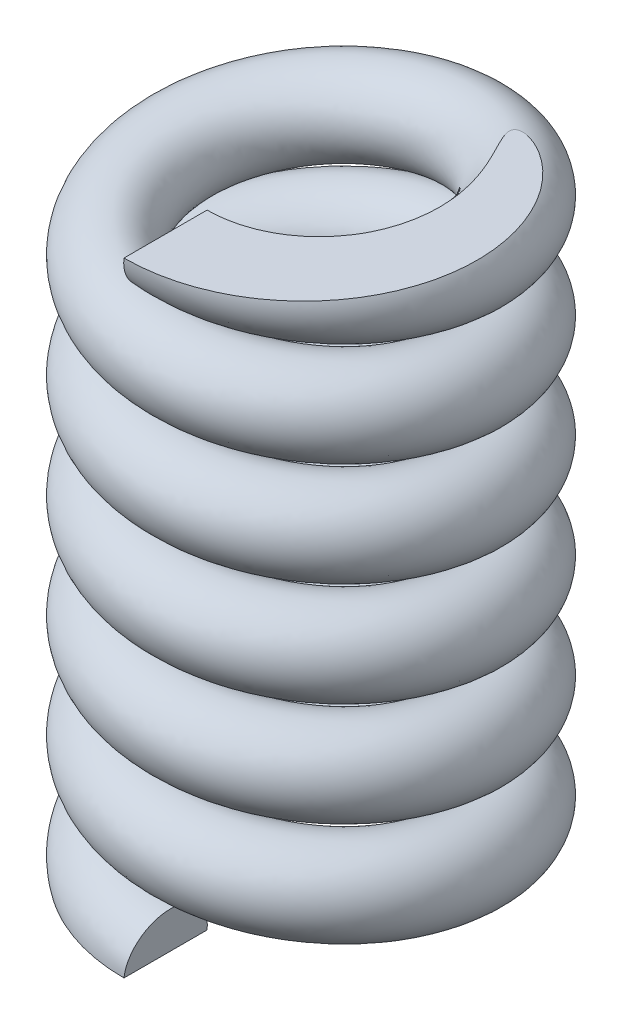
from build123d import *

# Parameters (mm, degrees)
SWEEP2_PITCH       = 2.5
SWEEP2_HEIGHT      = 15
SWEEP2_RADIUS      = 3.5
SWEEP2_PROFILE_R   = 1
SKETCH17_R         = 7
CUT_EXTRUDE1_DEPTH = 10
SKETCH18_R         = 7
CUT_EXTRUDE2_DEPTH = 10


with BuildPart() as part:
    # Sweep2: sweep along a helix
    with BuildLine() as sweep2_path:
        Helix(SWEEP2_PITCH, SWEEP2_HEIGHT, SWEEP2_RADIUS, center=(0, 0, 0), direction=(0, 1, 0), lefthand=True)
    # Sweep2 profile (on start of the path) → Sweep2 (sweep)
    with BuildSketch(Plane(origin=(0, 0, 3.5), x_dir=(-0.11295455441066544, -0.9936001553129348, 0), z_dir=(-0.9936001553129348, 0.11295455441066544, -4.146218604926328e-13))):
        Circle(SWEEP2_PROFILE_R)
    sweep(path=sweep2_path.line, is_frenet=True)

    # Sketch17 → Cut-Extrude1 (cut)
    with BuildSketch(Plane(origin=(0, 0, 0), x_dir=(1, 0, 0), z_dir=(0, 1, 0))):
        Circle(SKETCH17_R)
    extrude(amount=-CUT_EXTRUDE1_DEPTH, mode=Mode.SUBTRACT)

    # Sketch18 → Cut-Extrude2 (cut)
    with BuildSketch(Plane(origin=(0, 15, 0), x_dir=(-1, 0, 0), z_dir=(0, -1, 0))):
        Circle(SKETCH18_R)
    extrude(amount=-CUT_EXTRUDE2_DEPTH, mode=Mode.SUBTRACT)


solid = part.part
